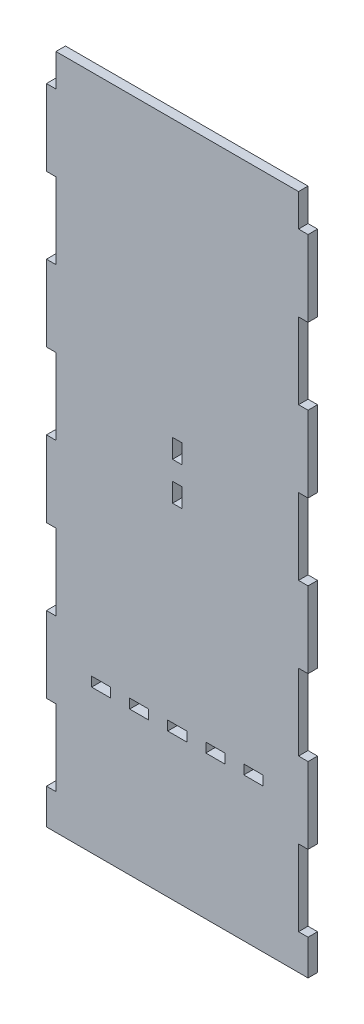
from build123d import *

# Parameters (mm, degrees)
SKETCH1_W           = 6.35
SKETCH1_H           = 3.175
SKETCH1_W_2         = 3.175
SKETCH1_H_2         = 6.35
BOSS_EXTRUDE1_DEPTH = 3.175


with BuildPart() as part:
    # Sketch1 → Boss-Extrude1 (new body)
    with BuildSketch(Plane.XY):
        Polygon((0, 268.0208), (81, 268.0208), (81, 257.175), (84.175, 257.175), (84.175, 231.775), (81, 231.775), (81, 206.375), (84.175, 206.375), (84.175, 180.975), (81, 180.975), (81, 155.575), (84.175, 155.575), (84.175, 130.175), (81, 130.175), (81, 104.775), (84.175, 104.775), (84.175, 79.375), (81, 79.375), (81, 53.975), (84.175, 53.975), (84.175, 42.175), (-3.175, 42.175), (-3.175, 53.975), (0, 53.975), (0, 79.375), (-3.175, 79.375), (-3.175, 104.775), (0, 104.775), (0, 130.175), (-3.175, 130.175), (-3.175, 155.575), (0, 155.575), (0, 180.975), (-3.175, 180.975), (-3.175, 206.375), (0, 206.375), (0, 231.775), (-3.175, 231.775), (-3.175, 257.175), (0, 257.175), align=None)
        with Locations((53.2, 91.7575)):
            Rectangle(SKETCH1_W, SKETCH1_H, mode=Mode.SUBTRACT)
        with Locations((40.5, 91.7575)):
            Rectangle(SKETCH1_W, SKETCH1_H, mode=Mode.SUBTRACT)
        with Locations((65.9, 91.7575)):
            Rectangle(SKETCH1_W, SKETCH1_H, mode=Mode.SUBTRACT)
        with Locations((27.8, 91.7575)):
            Rectangle(SKETCH1_W, SKETCH1_H, mode=Mode.SUBTRACT)
        with Locations((15.1, 91.7575)):
            Rectangle(SKETCH1_W, SKETCH1_H, mode=Mode.SUBTRACT)
        with Locations((40.5, 160.02)):
            Rectangle(SKETCH1_W_2, SKETCH1_H_2, mode=Mode.SUBTRACT)
        with Locations((40.5, 172.72)):
            Rectangle(SKETCH1_W_2, SKETCH1_H_2, mode=Mode.SUBTRACT)
    extrude(amount=BOSS_EXTRUDE1_DEPTH)


solid = part.part
